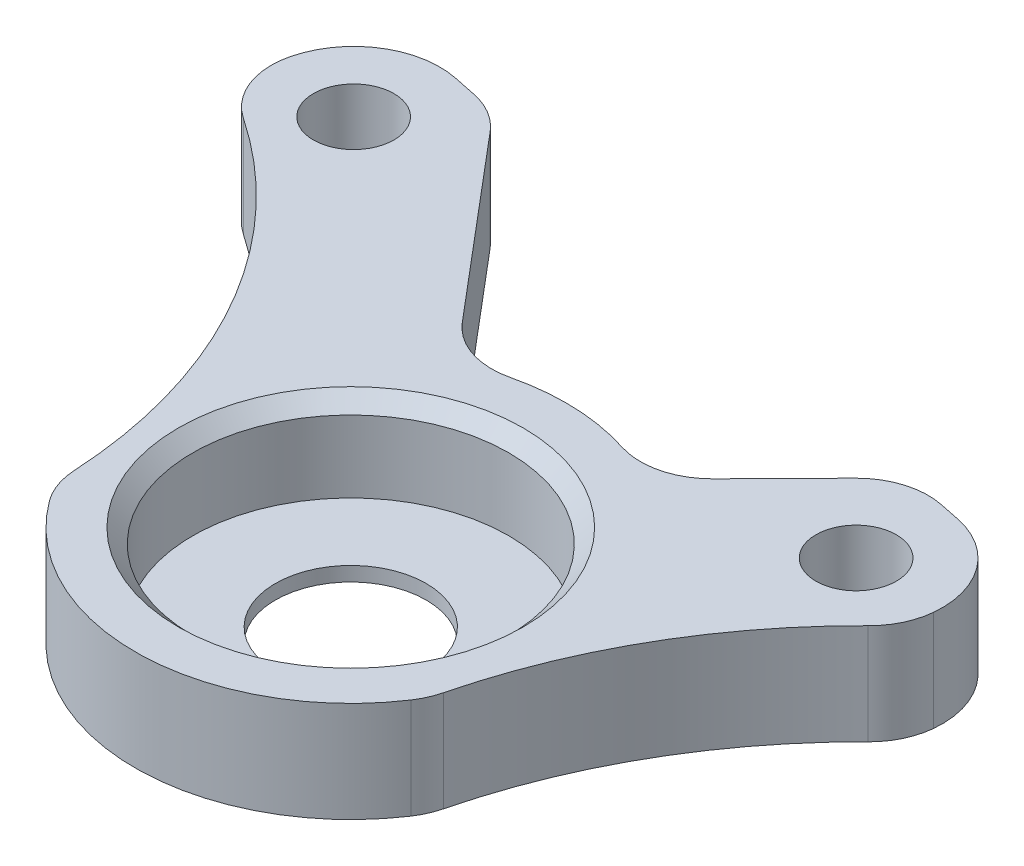
from build123d import *
from build123d.topology import SkipClean

# Parameters (mm, degrees)
SKETCH1_R           = 11
SKETCH1_R_2         = 2.8
BOSS_EXTRUDE1_DEPTH = 6
CUT_EXTRUDE4_REACH  = 45.897
CHAMFER1_SIZE       = 1
CUT_EXTRUDE3_DEPTH  = 44.897208358
BOSS_EXTRUDE2_START = 1
SKETCH4_R           = 2.8
SKETCH4_R_2         = 5.25
BOSS_EXTRUDE2_DEPTH = 1
FILLET1_R           = 5


with BuildPart() as part:
    # Sketch1 → Boss-Extrude1 (new body)
    with BuildSketch(Plane(origin=(0, 0, 0), x_dir=(1, 0, 0), z_dir=(0, 1, 0))):
        with BuildLine():
            Line((-13.007470321, -7.470322339), (-29.852085541, 21.859848784))
            ThreePointArc((-29.852085541, 21.859848784), (-29.509233169, 28.366369458), (-23.435152239, 30.723889318))
            Line((-23.435152239, 30.723889318), (20.634184752, 21.61930052))
            ThreePointArc((20.634184752, 21.61930052), (24.891716701, 18.205692335), (24.623227707, 12.755259985))
            Line((24.623227707, 12.755259985), (13.007470321, -7.470322339))
            ThreePointArc((13.007470321, -7.470322339), (0, -15), (-13.007470321, -7.470322339))
        make_face()
        with Locations(Location((0, 0, 0), (0, 0, 270))):
            Circle(SKETCH1_R, mode=Mode.SUBTRACT)
        with Locations(Location((-24.649097412, 24.84797772, 0), (0, 0, 270))):
            Circle(SKETCH1_R_2, mode=Mode.SUBTRACT)
        with Locations(Location((19.420239578, 15.743388921, 0), (0, 0, 270))):
            Circle(SKETCH1_R_2, mode=Mode.SUBTRACT)
    extrude(amount=BOSS_EXTRUDE1_DEPTH)

    # Sketch6 → Cut-Extrude4 (cut, up to next)
    with BuildSketch(Plane(origin=(0, 6, 0), x_dir=(1, 0, 0), z_dir=(0, 1, 0)), mode=Mode.PRIVATE) as cut_extrude4_sk1:
        with BuildLine():
            Line((-6.271623509, 13.625958262), (-20.135130689, 30.042115067))
            Line((-20.135130689, 30.042115067), (16.502166132, 22.472962794))
            Line((16.502166132, 22.472962794), (7.288797568, 13.110050725))
            ThreePointArc((7.288797568, 13.110050725), (0.570263898, 14.98915605), (-6.271623509, 13.625958262))
        make_face()
    cut_extrude4_tool1 = extrude(cut_extrude4_sk1.sketch, amount=-CUT_EXTRUDE4_REACH, mode=Mode.PRIVATE) & part.part
    add(cut_extrude4_tool1.solids().sort_by_distance((-1.480045, 6, -21.203105))[0], mode=Mode.SUBTRACT)

    # Chamfer1
    chamfer1_edges = [part.edges().sort_by_distance(p)[0] for p in [
        (0, 6, -11),
    ]]
    chamfer(chamfer1_edges, length=CHAMFER1_SIZE)

    # Sketch5 → Cut-Extrude3 (cut, through all)
    with BuildSketch(Plane(origin=(0, 6, 0), x_dir=(1, 0, 0), z_dir=(0, 1, 0))):
        with BuildLine():
            Line((-29.852085541, 21.859848784), (-13.007470321, -7.470322339))
            ThreePointArc((-13.007470321, -7.470322339), (-17.651634078, 9.364589617), (-29.852085541, 21.859848784))
        make_face()
        with BuildLine():
            Line((13.007470321, -7.470322339), (24.623227707, 12.755259985))
            ThreePointArc((24.623227707, 12.755259985), (17.308436126, 3.507904202), (13.007470321, -7.470322339))
        make_face()
    extrude(amount=-CUT_EXTRUDE3_DEPTH, mode=Mode.SUBTRACT)

    # Sketch4 → Boss-Extrude2 (add)
    with SkipClean():  # the faces are left unmerged after this step: merging them gives an invalid solid
        with BuildSketch(Plane.XZ.offset(BOSS_EXTRUDE2_START)):
            with BuildLine():
                Line((16.502166132, -22.472962794), (20.634184752, -21.61930052))
                ThreePointArc((20.634184752, -21.61930052), (24.891716701, -18.205692335), (24.623227707, -12.755259985))
                ThreePointArc((24.623227707, -12.755259985), (17.308436126, -3.507904202), (13.007470321, 7.470322339))
                ThreePointArc((13.007470321, 7.470322339), (0, 15), (-13.007470321, 7.470322339))
                ThreePointArc((-13.007470321, 7.470322339), (-17.651634078, -9.364589617), (-29.852085541, -21.859848784))
                ThreePointArc((-29.852085541, -21.859848784), (-29.509233169, -28.366369458), (-23.435152239, -30.723889318))
                Line((-23.435152239, -30.723889318), (-20.135130689, -30.042115067))
                Line((-20.135130689, -30.042115067), (-6.271623509, -13.625958262))
                ThreePointArc((-6.271623509, -13.625958262), (0.570263898, -14.98915605), (7.288797568, -13.110050725))
                Line((7.288797568, -13.110050725), (16.502166132, -22.472962794))
            make_face()
            with Locations(Location((19.420239578, -15.743388921, 0), (0, 0, 270))):
                Circle(SKETCH4_R, mode=Mode.SUBTRACT)
            with Locations(Location((-24.649097412, -24.84797772, 0), (0, 0, 270))):
                Circle(SKETCH4_R, mode=Mode.SUBTRACT)
            with Locations(Location((0, 0, 0), (0, 0, 270))):
                Circle(SKETCH4_R_2, mode=Mode.SUBTRACT)
        extrude(amount=-BOSS_EXTRUDE2_DEPTH)

    # Fillet1
    fillet1_edges = [part.edges().sort_by_distance(p)[0] for p in [
        (-13.007470321, 3, 7.470322339),
        (-29.852085541, 3, -21.859848784),
        (24.623227707, 3, -12.755259985),
        (13.007470321, 3, 7.470322339),
        (7.288797568, 3, -13.110050725),
        (-6.271623509, 3, -13.625958262),
        (-20.135130689, 3, -30.042115067),
        (16.502166132, 3, -22.472962794),
    ]]
    fillet(fillet1_edges, radius=FILLET1_R)


solid = part.part
